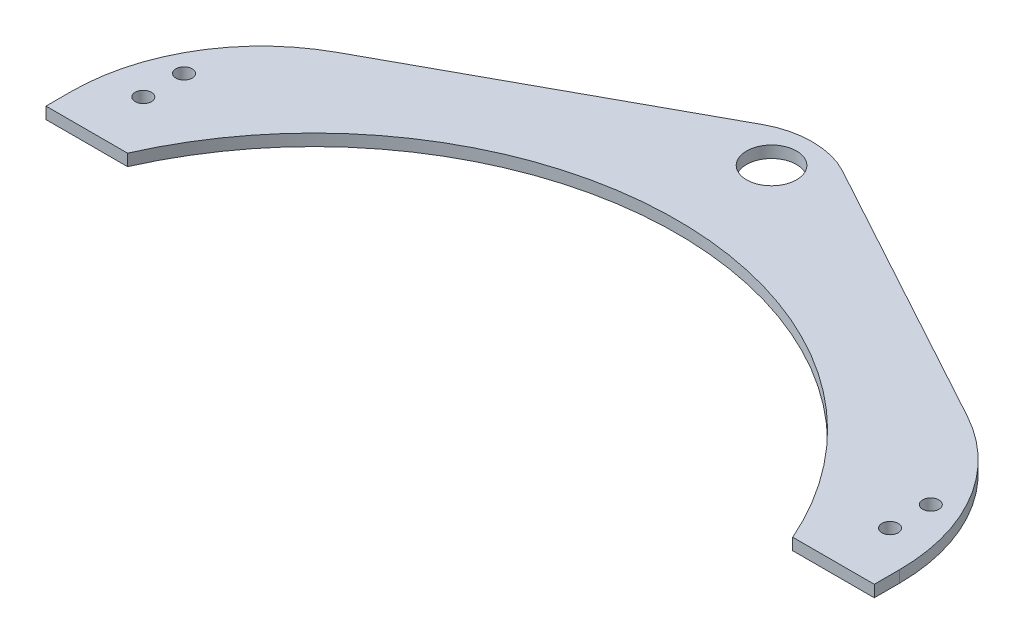
from build123d import *

# Parameters (mm, degrees)
SKETCH1_R           = 4.6
SKETCH1_R_2         = 1.5
BOSS_EXTRUDE2_DEPTH = 3.175
SKETCH2_W           = 235.965281387
SKETCH2_H           = 118.721671229
CUT_EXTRUDE1_DEPTH  = 1.016


with BuildPart() as part:
    # Sketch1 → Boss-Extrude2 (new body)
    with BuildSketch(Plane(origin=(0, 0, 0), x_dir=(1, 0, 0), z_dir=(0, 1, 0))):
        with BuildLine():
            Line((-7.5, 0), (0, 0))
            ThreePointArc((0, 0), (61.2, 39.907584028), (122.4, 0))
            Line((122.4, 0), (129.9, 0))
            Line((129.9, 0), (137.4, 0))
            Line((137.4, 0), (137.4, 4.627434139))
            ThreePointArc((137.4, 4.627434139), (132.49819386, 22.490768832), (119.165787065, 35.350526172))
            Line((119.165787065, 35.350526172), (68.55887696, 62.967039443))
            ThreePointArc((68.55887696, 62.967039443), (65.081261882, 64.334538033), (61.373539646, 64.8))
            Line((61.373539646, 64.8), (61.026460354, 64.8))
            ThreePointArc((61.026460354, 64.8), (57.318738118, 64.334538033), (53.84112304, 62.967039443))
            Line((53.84112304, 62.967039443), (3.234212935, 35.350526172))
            ThreePointArc((3.234212935, 35.350526172), (-10.09819386, 22.490768832), (-15, 4.627434139))
            Line((-15, 4.627434139), (-15, 0))
            Line((-15, 0), (-7.5, 0))
        make_face()
        with Locations(Location((61.2, 57.3, 0), (0, 0, 270))):
            Circle(SKETCH1_R, mode=Mode.SUBTRACT)
        with BuildLine():
            ThreePointArc((-7.5, 8.9), (-9, 10.4), (-7.5, 11.9))
            ThreePointArc((-7.5, 11.9), (-6, 10.4), (-7.5, 8.9))
        make_face(mode=Mode.SUBTRACT)
        with Locations(Location((-7.5, 17.9, 0), (0, 0, 270))):
            Circle(SKETCH1_R_2, mode=Mode.SUBTRACT)
        with BuildLine():
            ThreePointArc((129.9, 8.9), (128.4, 10.4), (129.9, 11.9))
            ThreePointArc((129.9, 11.9), (131.4, 10.4), (129.9, 8.9))
        make_face(mode=Mode.SUBTRACT)
        with Locations(Location((129.9, 17.9, 0), (0, 0, 270))):
            Circle(SKETCH1_R_2, mode=Mode.SUBTRACT)
    extrude(amount=BOSS_EXTRUDE2_DEPTH)

    # Sketch2 → Cut-Extrude1 (cut)
    with BuildSketch(Plane(origin=(0, 3.175, 0), x_dir=(1, 0, 0), z_dir=(0, 1, 0))):
        with Locations((50.311488443, 30.817995662)):
            Rectangle(SKETCH2_W, SKETCH2_H)
    extrude(amount=-CUT_EXTRUDE1_DEPTH, mode=Mode.SUBTRACT)


solid = part.part
